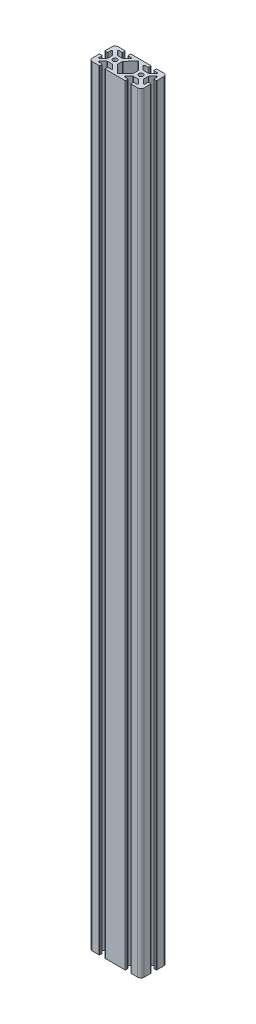
from build123d import *

# Parameters (mm, degrees)
BOSS_EXTRUDE1_DEPTH   = 1190
SKETCH3_R             = 3.4
CUT_EXTRUDE1_DEPTH    = 1194.356610574
CUT_EXTRUDE2_DEPTH    = 1194.356610574
FILLET1_R             = 1
FILLET2_R             = 1
FILLET3_R             = 1
CUT_EXTRUDE3_DEPTH    = 1194.356610574
CUT_EXTRUDE4_DEPTH    = 1194.356610574
FILLET4_R             = 1
FILLET5_R             = 1
FILLET6_R             = 1
FILLET7_R             = 1
FILLET8_R             = 1
FILLET9_R             = 1
FILLET10_R            = 1
FILLET11_R            = 1
MIRROR11_COPY_1_DEPTH = 1194.356610574
MIRROR11_COPY_2_DEPTH = 1194.356610574
CUT_EXTRUDE5_DEPTH    = 1194.356610574


with BuildPart() as part:
    # Sketch1 → Boss-Extrude1 (new body)
    with BuildSketch(Plane(origin=(0, 0, 0), x_dir=(1, 0, 0), z_dir=(0, 1, 0))):
        with BuildLine():
            Line((5, 0), (75, 0))
            ThreePointArc((75, 0), (78.535533906, -1.464466094), (80, -5))
            Line((80, -5), (80, -35))
            ThreePointArc((80, -35), (78.535533906, -38.535533906), (75, -40))
            Line((75, -40), (5, -40))
            ThreePointArc((5, -40), (1.464466094, -38.535533906), (0, -35))
            Line((0, -35), (0, -5))
            ThreePointArc((0, -5), (1.464466094, -1.464466094), (5, 0))
        make_face()
    extrude(amount=BOSS_EXTRUDE1_DEPTH)

    # Sketch3 → Cut-Extrude1 (cut, through all)
    with BuildSketch(Plane(origin=(0, 1190, 0), x_dir=(1, 0, 0), z_dir=(0, 1, 0))):
        with Locations(Location((20, -20, 0), (0, 0, 270))):
            Circle(SKETCH3_R)
    cut_extrude1 = extrude(amount=-CUT_EXTRUDE1_DEPTH, mode=Mode.SUBTRACT)

    # Mirror3: Cut-Extrude1 across plane
    add(cut_extrude1.mirror(Plane(origin=(40, 0, 0), x_dir=(0, 0, 1), z_dir=(1, 0, 0))), mode=Mode.SUBTRACT)

    # Sketch7 → Cut-Extrude2 (cut, through all)
    with BuildSketch(Plane(origin=(0, 0, 0), x_dir=(-1, 0, 0), z_dir=(0, -1, 0))):
        with BuildLine():
            Line((-15.9, -40), (-24.1, -40))
            Line((-24.1, -40), (-24.1, -36.5))
            ThreePointArc((-24.1, -36.5), (-24.392893219, -35.792893219), (-25.1, -35.5))
            Line((-25.1, -35.5), (-29.489753594, -35.5))
            ThreePointArc((-29.489753594, -35.5), (-30.415270825, -34.8787055), (-30.190750526, -33.786835712))
            Line((-30.190750526, -33.786835712), (-24.391814382, -28.086835712))
            ThreePointArc((-24.391814382, -28.086835712), (-24.069522951, -27.874482769), (-23.69081745, -27.8))
            Line((-23.69081745, -27.8), (-16.309186536, -27.8))
            ThreePointArc((-16.309186536, -27.8), (-15.930477876, -27.874484063), (-15.608184734, -28.086840499))
            Line((-15.608184734, -28.086840499), (-9.809327805, -33.786840499))
            ThreePointArc((-9.809327805, -33.786840499), (-9.584813669, -34.87870866), (-10.510329607, -35.5))
            Line((-10.510329607, -35.5), (-14.9, -35.5))
            ThreePointArc((-14.9, -35.5), (-15.607106781, -35.792893219), (-15.9, -36.5))
            Line((-15.9, -36.5), (-15.9, -40))
        make_face()
    cut_extrude2 = extrude(amount=-CUT_EXTRUDE2_DEPTH, mode=Mode.SUBTRACT)

    # Fillet1
    fillet1_edges = [part.edges().sort_by_distance(p)[0] for p in [
        (15.9, 595, 40),
        (24.1, 595, 40),
    ]]
    fillet(fillet1_edges, radius=FILLET1_R)

    # Mirror8: Cut-Extrude2 across plane
    add(cut_extrude2.mirror(Plane(origin=(40, 0, 0), x_dir=(0, 0, 1), z_dir=(1, 0, 0))), mode=Mode.SUBTRACT)

    # Fillet2
    fillet2_edges = [part.edges().sort_by_distance(p)[0] for p in [
        (55.9, 595, 40),
    ]]
    fillet(fillet2_edges, radius=FILLET2_R)

    # Fillet3
    fillet3_edges = [part.edges().sort_by_distance(p)[0] for p in [
        (64.1, 595, 40),
    ]]
    fillet(fillet3_edges, radius=FILLET3_R)

    # Sketch9 → Cut-Extrude3 (cut, through all)
    with BuildSketch(Plane(origin=(0, 0, 0), x_dir=(1, 0, 0), z_dir=(0, 1, 0))):
        with BuildLine():
            Line((14.899846923, -4.500713815), (10.450461284, -4.500713815))
            ThreePointArc((10.450461284, -4.500713815), (9.526581751, -5.118030383), (9.743354502, -6.207820596))
            Line((9.743354502, -6.207820596), (15.442640687, -11.907106781))
            ThreePointArc((15.442640687, -11.907106781), (15.767064036, -12.123879533), (16.149747468, -12.2))
            Line((16.149747468, -12.2), (23.850252532, -12.2))
            ThreePointArc((23.850252532, -12.2), (24.232935964, -12.123879533), (24.557359313, -11.907106781))
            Line((24.557359313, -11.907106781), (30.257359313, -6.207106781))
            ThreePointArc((30.257359313, -6.207106781), (30.474132064, -5.117316568), (29.550252532, -4.5))
            Line((29.550252532, -4.5), (25.099846964, -4.5))
            ThreePointArc((25.099846964, -4.5), (24.392724723, -4.207091321), (24.099846965, -3.499956273))
            Line((24.099846965, -3.499956273), (24.100000008, 0))
            Line((24.100000008, 0), (15.9, 0))
            Line((15.9, 0), (15.899846922, -3.500757542))
            ThreePointArc((15.899846922, -3.500757542), (15.606938244, -4.207836056), (14.899846923, -4.500713815))
        make_face()
    cut_extrude3 = extrude(amount=CUT_EXTRUDE3_DEPTH, mode=Mode.SUBTRACT)

    # Mirror9: Cut-Extrude3 across plane
    add(cut_extrude3.mirror(Plane(origin=(40, 0, 0), x_dir=(0, 0, 1), z_dir=(1, 0, 0))), mode=Mode.SUBTRACT)

    # Sketch10 → Cut-Extrude4 (cut, through all)
    with BuildSketch(Plane(origin=(0, 0, 0), x_dir=(1, 0, 0), z_dir=(0, 1, 0))):
        with BuildLine():
            Line((4.5, -14.9), (4.5, -10.58605332))
            ThreePointArc((4.5, -10.58605332), (5.126159695, -9.658560233), (6.220486853, -9.892584724))
            Line((6.220486853, -9.892584724), (11.920486853, -15.814662646))
            ThreePointArc((11.920486853, -15.814662646), (12.127493087, -16.134290938), (12.2, -16.508131242))
            Line((12.2, -16.508131242), (12.2, -23.491868758))
            ThreePointArc((12.2, -23.491868758), (12.127493087, -23.865709062), (11.920486853, -24.185337354))
            Line((11.920486853, -24.185337354), (6.220486853, -30.107415276))
            ThreePointArc((6.220486853, -30.107415276), (5.126159695, -30.341439767), (4.5, -29.41394668))
            Line((4.5, -29.41394668), (4.5, -25.1))
            ThreePointArc((4.5, -25.1), (4.207106781, -24.392893219), (3.5, -24.1))
            Line((3.5, -24.1), (0, -24.1))
            Line((0, -24.1), (0, -15.9))
            Line((0, -15.9), (3.5, -15.9))
            ThreePointArc((3.5, -15.9), (4.207106781, -15.607106781), (4.5, -14.9))
        make_face()
    cut_extrude4 = extrude(amount=CUT_EXTRUDE4_DEPTH, mode=Mode.SUBTRACT)

    # Fillet4
    fillet4_edges = [part.edges().sort_by_distance(p)[0] for p in [
        (24.100000008, 595, 0),
    ]]
    fillet(fillet4_edges, radius=FILLET4_R)

    # Fillet5
    fillet5_edges = [part.edges().sort_by_distance(p)[0] for p in [
        (64.1, 595, 0),
    ]]
    fillet(fillet5_edges, radius=FILLET5_R)

    # Fillet6
    fillet6_edges = [part.edges().sort_by_distance(p)[0] for p in [
        (55.899999992, 595, 0),
    ]]
    fillet(fillet6_edges, radius=FILLET6_R)

    # Fillet7
    fillet7_edges = [part.edges().sort_by_distance(p)[0] for p in [
        (15.9, 595, 0),
    ]]
    fillet(fillet7_edges, radius=FILLET7_R)

    # Fillet8
    fillet8_edges = [part.edges().sort_by_distance(p)[0] for p in [
        (0, 595, 24.1),
    ]]
    fillet(fillet8_edges, radius=FILLET8_R)

    # Fillet9
    fillet9_edges = [part.edges().sort_by_distance(p)[0] for p in [
        (0, 595, 15.9),
    ]]
    fillet(fillet9_edges, radius=FILLET9_R)

    # Mirror10: Cut-Extrude4 across plane
    add(cut_extrude4.mirror(Plane(origin=(40, 0, 0), x_dir=(0, 0, 1), z_dir=(1, 0, 0))), mode=Mode.SUBTRACT)

    # Fillet10
    fillet10_edges = [part.edges().sort_by_distance(p)[0] for p in [
        (80, 595, 15.9),
    ]]
    fillet(fillet10_edges, radius=FILLET10_R)

    # Fillet11
    fillet11_edges = [part.edges().sort_by_distance(p)[0] for p in [
        (80, 595, 24.1),
    ]]
    fillet(fillet11_edges, radius=FILLET11_R)

    # Mirror11 copy 1 sketch → Mirror11 copy 1 (cut, through all)
    with BuildSketch(Plane(origin=(40, 0, 0), x_dir=(1, 0, 0), z_dir=(0, 1, 0))):
        with BuildLine():
            Line((4.5, -14.9), (4.5, -10.58605332))
            ThreePointArc((4.5, -10.58605332), (5.126159695, -9.658560233), (6.220486853, -9.892584724))
            Line((6.220486853, -9.892584724), (11.920486853, -15.814662646))
            ThreePointArc((11.920486853, -15.814662646), (12.127493087, -16.134290938), (12.2, -16.508131242))
            Line((12.2, -16.508131242), (12.2, -23.491868758))
            ThreePointArc((12.2, -23.491868758), (12.127493087, -23.865709062), (11.920486853, -24.185337354))
            Line((11.920486853, -24.185337354), (6.220486853, -30.107415276))
            ThreePointArc((6.220486853, -30.107415276), (5.126159695, -30.341439767), (4.5, -29.41394668))
            Line((4.5, -29.41394668), (4.5, -25.1))
            ThreePointArc((4.5, -25.1), (4.207106781, -24.392893219), (3.5, -24.1))
            Line((3.5, -24.1), (0, -24.1))
            Line((0, -24.1), (0, -15.9))
            Line((0, -15.9), (3.5, -15.9))
            ThreePointArc((3.5, -15.9), (4.207106781, -15.607106781), (4.5, -14.9))
        make_face()
    extrude(amount=MIRROR11_COPY_1_DEPTH, mode=Mode.SUBTRACT)

    # Mirror11 copy 2 sketch → Mirror11 copy 2 (cut, through all)
    with BuildSketch(Plane(origin=(120, 0, 0), x_dir=(-1, 0, 0), z_dir=(0, 1, 0))):
        with BuildLine():
            Line((4.5, 14.9), (4.5, 10.58605332))
            ThreePointArc((4.5, 10.58605332), (5.126159695, 9.658560233), (6.220486853, 9.892584724))
            Line((6.220486853, 9.892584724), (11.920486853, 15.814662646))
            ThreePointArc((11.920486853, 15.814662646), (12.127493087, 16.134290938), (12.2, 16.508131242))
            Line((12.2, 16.508131242), (12.2, 23.491868758))
            ThreePointArc((12.2, 23.491868758), (12.127493087, 23.865709062), (11.920486853, 24.185337354))
            Line((11.920486853, 24.185337354), (6.220486853, 30.107415276))
            ThreePointArc((6.220486853, 30.107415276), (5.126159695, 30.341439767), (4.5, 29.41394668))
            Line((4.5, 29.41394668), (4.5, 25.1))
            ThreePointArc((4.5, 25.1), (4.207106781, 24.392893219), (3.5, 24.1))
            Line((3.5, 24.1), (0, 24.1))
            Line((0, 24.1), (0, 15.9))
            Line((0, 15.9), (3.5, 15.9))
            ThreePointArc((3.5, 15.9), (4.207106781, 15.607106781), (4.5, 14.9))
        make_face()
    extrude(amount=MIRROR11_COPY_2_DEPTH, mode=Mode.SUBTRACT)

    # Mirror12: Cut-Extrude4 across plane
    add(cut_extrude4.mirror(Plane.ZY.offset(-20)), mode=Mode.SUBTRACT)

    # Sketch12 → Cut-Extrude5 (cut, through all)
    with BuildSketch(Plane(origin=(0, 0, 0), x_dir=(-1, 0, 0), z_dir=(0, -1, 0))):
        with BuildLine():
            Line((-28.079513147, -24.185337354), (-39.327067998, -35.871108628))
            ThreePointArc((-39.327067998, -35.871108628), (-40.049082116, -36.177638866), (-40.770156561, -35.868904648))
            Line((-40.770156561, -35.868904648), (-51.922601709, -24.210885791))
            ThreePointArc((-51.922601709, -24.210885791), (-52.128062958, -23.892044517), (-52.2, -23.519621175))
            Line((-52.2, -23.519621175), (-52.2, -16.508131242))
            ThreePointArc((-52.2, -16.508131242), (-52.127493087, -16.134290938), (-51.920486853, -15.814662646))
            Line((-51.920486853, -15.814662646), (-40.720486853, -4.17829901))
            ThreePointArc((-40.720486853, -4.17829901), (-40, -3.871767606), (-39.279513147, -4.17829901))
            Line((-39.279513147, -4.17829901), (-28.079513147, -15.814662646))
            ThreePointArc((-28.079513147, -15.814662646), (-27.872506913, -16.134290938), (-27.8, -16.508131242))
            Line((-27.8, -16.508131242), (-27.8, -23.491868758))
            ThreePointArc((-27.8, -23.491868758), (-27.872506913, -23.865709062), (-28.079513147, -24.185337354))
        make_face()
    extrude(amount=-CUT_EXTRUDE5_DEPTH, mode=Mode.SUBTRACT)


solid = part.part
